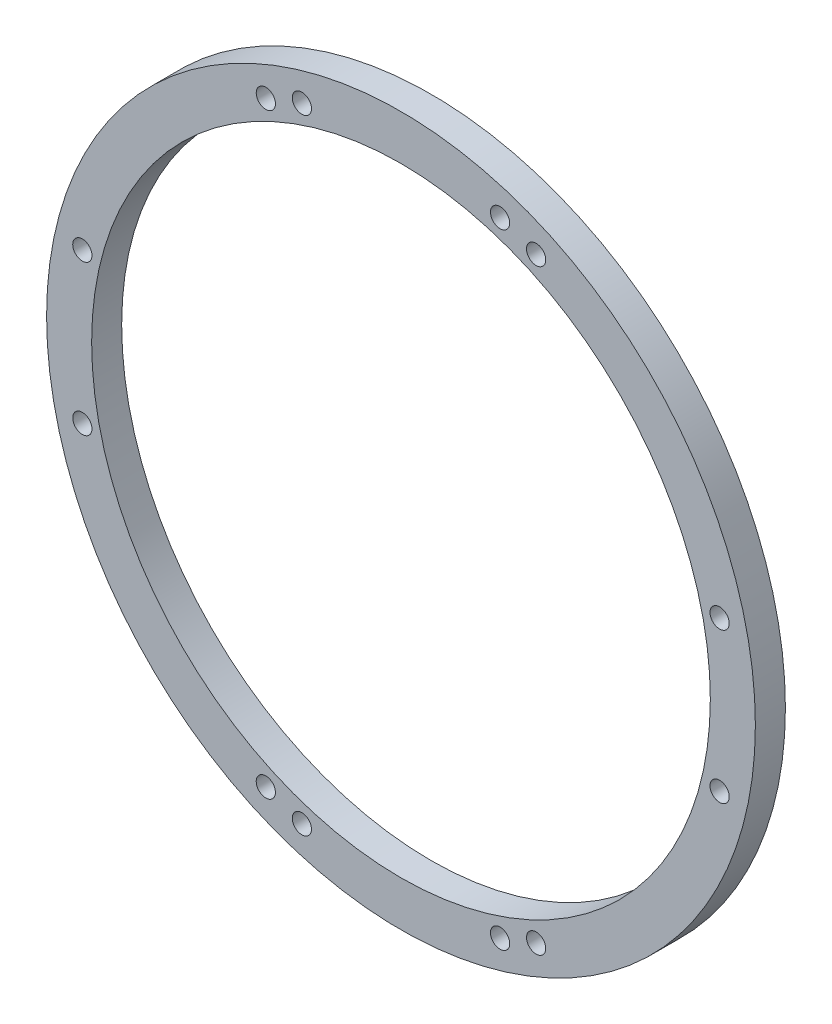
from build123d import *

# Parameters (mm, degrees)
SKETCH_1_R      = 59
SKETCH_1_R_2    = 51.5
SKETCH_1_R_3    = 1.6
EXTRUDE_1_DEPTH = 5


with BuildPart() as part:
    # 草图1 → 凸台-拉伸1 (new body)
    with BuildSketch(Plane.XY):
        Circle(SKETCH_1_R)
        Circle(SKETCH_1_R_2, mode=Mode.SUBTRACT)
        with Locations((16.5, 51.942275653)):
            Circle(SKETCH_1_R_3, mode=Mode.SUBTRACT)
        with Locations((22.5, 49.638694584)):
            Circle(SKETCH_1_R_3, mode=Mode.SUBTRACT)
        with Locations((53.047148839, 12.5)):
            Circle(SKETCH_1_R_3, mode=Mode.SUBTRACT)
        with Locations(Location((22.5, -49.638694584, 0), (0, 0, 180))):
            Circle(SKETCH_1_R_3, mode=Mode.SUBTRACT)
        with Locations(Location((16.5, -51.942275653, 0), (0, 0, 180))):
            Circle(SKETCH_1_R_3, mode=Mode.SUBTRACT)
        with Locations(Location((53.047148839, -12.5, 0), (0, 0, 180))):
            Circle(SKETCH_1_R_3, mode=Mode.SUBTRACT)
        with Locations((-16.5, -51.942275653)):
            Circle(SKETCH_1_R_3, mode=Mode.SUBTRACT)
        with Locations((-22.5, -49.638694584)):
            Circle(SKETCH_1_R_3, mode=Mode.SUBTRACT)
        with Locations((-53.047148839, -12.5)):
            Circle(SKETCH_1_R_3, mode=Mode.SUBTRACT)
        with Locations(Location((-53.047148839, 12.5, 0), (0, 0, 180))):
            Circle(SKETCH_1_R_3, mode=Mode.SUBTRACT)
        with Locations(Location((-22.5, 49.638694584, 0), (0, 0, 180))):
            Circle(SKETCH_1_R_3, mode=Mode.SUBTRACT)
        with Locations(Location((-16.5, 51.942275653, 0), (0, 0, 180))):
            Circle(SKETCH_1_R_3, mode=Mode.SUBTRACT)
    extrude(amount=EXTRUDE_1_DEPTH)


solid = part.part
